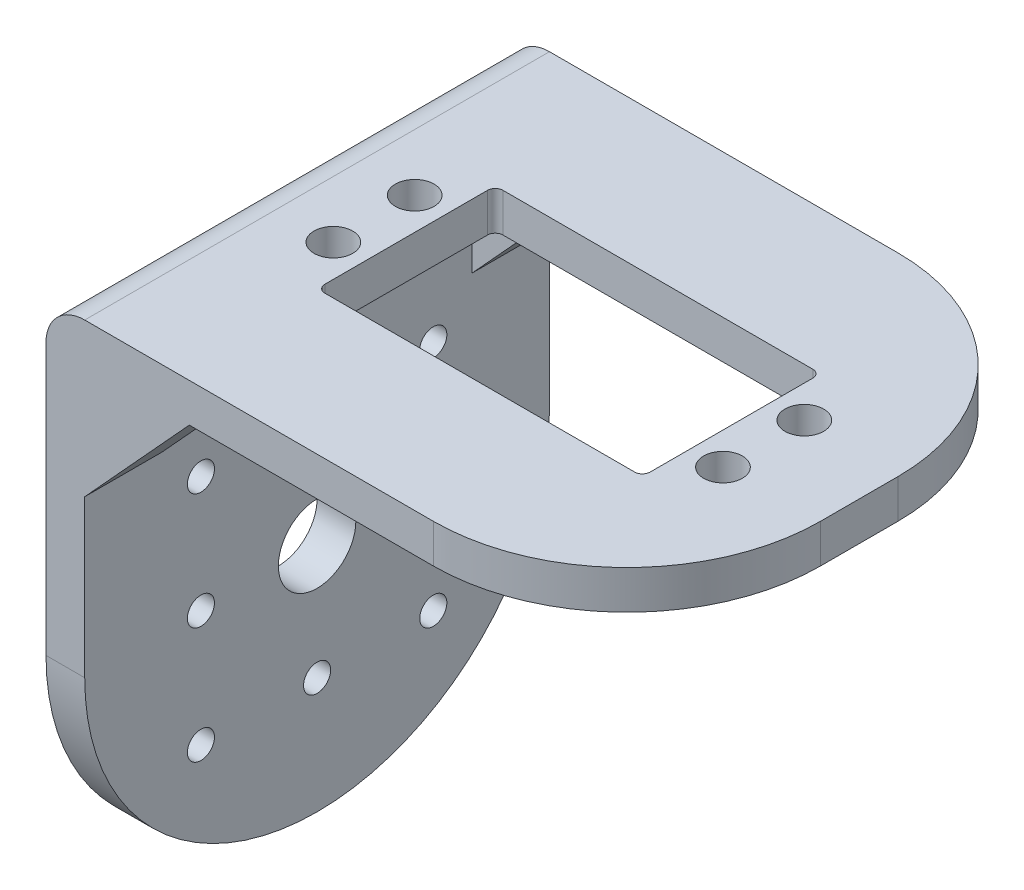
from build123d import *

# Parameters (mm, degrees)
BOSS_EXTRUDE1_DEPTH = 5
CUT_EXTRUDE1_REACH  = 58.403
SKETCH2_R           = 1.75
SKETCH4_W           = 75
SKETCH4_H           = 60
BOSS_EXTRUDE2_DEPTH = 5
CUT_EXTRUDE2_REACH  = 90.459
SKETCH3_R           = 2.5
SKETCH3_W           = 23
SKETCH3_H           = 42
FILLET1_R           = 25
FILLET2_R           = 5
FILLET3_R           = 2
FILLET4_R           = 1
BOSS_EXTRUDE3_DEPTH = 10
LPATTERN1_COUNT     = 2
LPATTERN1_PITCH     = 50
CUT_EXTRUDE3_REACH  = 95.708
SKETCH7_R           = 5


with BuildPart() as part:
    # Sketch1 → Boss-Extrude1 (new body)
    with BuildSketch(Plane(origin=(0, 0, 0), x_dir=(0, 0, -1), z_dir=(1, 0, 0))):
        with BuildLine():
            ThreePointArc((-30, -17.5), (0, -47.5), (30, -17.5))
            Line((30, -17.5), (30, 17.5))
            Line((30, 17.5), (-30, 17.5))
            Line((-30, 17.5), (-30, -17.5))
        make_face()
    extrude(amount=BOSS_EXTRUDE1_DEPTH)

    # Sketch2 → Cut-Extrude1 (cut, up to next)
    with BuildSketch(Plane(origin=(5, 0, 0), x_dir=(0, 0, -1), z_dir=(1, 0, 0)), mode=Mode.PRIVATE) as cut_extrude1_sk1:
        with Locations((-15, -32.5)):
            Circle(SKETCH2_R)
    cut_extrude1_tool1 = extrude(cut_extrude1_sk1.sketch, amount=-CUT_EXTRUDE1_REACH, mode=Mode.PRIVATE) & part.part
    # Sketch2 → Cut-Extrude1 (cut, up to next)
    with BuildSketch(Plane(origin=(5, 0, 0), x_dir=(0, 0, -1), z_dir=(1, 0, 0)), mode=Mode.PRIVATE) as cut_extrude1_sk2:
        with Locations((15, -32.5)):
            Circle(SKETCH2_R)
    cut_extrude1_tool2 = extrude(cut_extrude1_sk2.sketch, amount=-CUT_EXTRUDE1_REACH, mode=Mode.PRIVATE) & part.part
    # Sketch2 → Cut-Extrude1 (cut, up to next)
    with BuildSketch(Plane(origin=(5, 0, 0), x_dir=(0, 0, -1), z_dir=(1, 0, 0)), mode=Mode.PRIVATE) as cut_extrude1_sk3:
        with Locations((-15, -2.5)):
            Circle(SKETCH2_R)
    cut_extrude1_tool3 = extrude(cut_extrude1_sk3.sketch, amount=-CUT_EXTRUDE1_REACH, mode=Mode.PRIVATE) & part.part
    # Sketch2 → Cut-Extrude1 (cut, up to next)
    with BuildSketch(Plane(origin=(5, 0, 0), x_dir=(0, 0, -1), z_dir=(1, 0, 0)), mode=Mode.PRIVATE) as cut_extrude1_sk4:
        with Locations((0, -2.5)):
            Circle(SKETCH2_R)
    cut_extrude1_tool4 = extrude(cut_extrude1_sk4.sketch, amount=-CUT_EXTRUDE1_REACH, mode=Mode.PRIVATE) & part.part
    # Sketch2 → Cut-Extrude1 (cut, up to next)
    with BuildSketch(Plane(origin=(5, 0, 0), x_dir=(0, 0, -1), z_dir=(1, 0, 0)), mode=Mode.PRIVATE) as cut_extrude1_sk5:
        with Locations((15, -2.5)):
            Circle(SKETCH2_R)
    cut_extrude1_tool5 = extrude(cut_extrude1_sk5.sketch, amount=-CUT_EXTRUDE1_REACH, mode=Mode.PRIVATE) & part.part
    # Sketch2 → Cut-Extrude1 (cut, up to next)
    with BuildSketch(Plane(origin=(5, 0, 0), x_dir=(0, 0, -1), z_dir=(1, 0, 0)), mode=Mode.PRIVATE) as cut_extrude1_sk6:
        with Locations((0, -32.5)):
            Circle(SKETCH2_R)
    cut_extrude1_tool6 = extrude(cut_extrude1_sk6.sketch, amount=-CUT_EXTRUDE1_REACH, mode=Mode.PRIVATE) & part.part
    # Sketch2 → Cut-Extrude1 (cut, up to next)
    with BuildSketch(Plane(origin=(5, 0, 0), x_dir=(0, 0, -1), z_dir=(1, 0, 0)), mode=Mode.PRIVATE) as cut_extrude1_sk7:
        with Locations((-15, -17.5)):
            Circle(SKETCH2_R)
    cut_extrude1_tool7 = extrude(cut_extrude1_sk7.sketch, amount=-CUT_EXTRUDE1_REACH, mode=Mode.PRIVATE) & part.part
    # Sketch2 → Cut-Extrude1 (cut, up to next)
    with BuildSketch(Plane(origin=(5, 0, 0), x_dir=(0, 0, -1), z_dir=(1, 0, 0)), mode=Mode.PRIVATE) as cut_extrude1_sk8:
        with Locations((15, -17.5)):
            Circle(SKETCH2_R)
    cut_extrude1_tool8 = extrude(cut_extrude1_sk8.sketch, amount=-CUT_EXTRUDE1_REACH, mode=Mode.PRIVATE) & part.part
    add(cut_extrude1_tool1.solids().sort_by_distance((5, -32.5, 15))[0], mode=Mode.SUBTRACT)
    add(cut_extrude1_tool2.solids().sort_by_distance((5, -32.5, -15))[0], mode=Mode.SUBTRACT)
    add(cut_extrude1_tool3.solids().sort_by_distance((5, -2.5, 15))[0], mode=Mode.SUBTRACT)
    add(cut_extrude1_tool4.solids().sort_by_distance((5, -2.5, 0))[0], mode=Mode.SUBTRACT)
    add(cut_extrude1_tool5.solids().sort_by_distance((5, -2.5, -15))[0], mode=Mode.SUBTRACT)
    add(cut_extrude1_tool6.solids().sort_by_distance((5, -32.5, 0))[0], mode=Mode.SUBTRACT)
    add(cut_extrude1_tool7.solids().sort_by_distance((5, -17.5, 15))[0], mode=Mode.SUBTRACT)
    add(cut_extrude1_tool8.solids().sort_by_distance((5, -17.5, -15))[0], mode=Mode.SUBTRACT)

    # Sketch4 → Boss-Extrude2 (add)
    with BuildSketch(Plane(origin=(0, 17.5, 0), x_dir=(1, 0, 0), z_dir=(0, 1, 0))):
        with Locations((37.5, 0)):
            Rectangle(SKETCH4_W, SKETCH4_H)
    extrude(amount=BOSS_EXTRUDE2_DEPTH)

    # Sketch3 → Cut-Extrude2 (cut, up to next)
    with BuildSketch(Plane(origin=(30, 22.5, 0), x_dir=(0, 0, -1), z_dir=(0, 1, 0)), mode=Mode.PRIVATE) as cut_extrude2_sk1:
        with Locations((-5.25, 17.65)):
            Circle(SKETCH3_R)
    cut_extrude2_tool1 = extrude(cut_extrude2_sk1.sketch, amount=-CUT_EXTRUDE2_REACH, mode=Mode.PRIVATE) & part.part
    # Sketch3 → Cut-Extrude2 (cut, up to next)
    with BuildSketch(Plane(origin=(30, 22.5, 0), x_dir=(0, 0, -1), z_dir=(0, 1, 0)), mode=Mode.PRIVATE) as cut_extrude2_sk2:
        with Locations((5.25, 17.65)):
            Circle(SKETCH3_R)
    cut_extrude2_tool2 = extrude(cut_extrude2_sk2.sketch, amount=-CUT_EXTRUDE2_REACH, mode=Mode.PRIVATE) & part.part
    # Sketch3 → Cut-Extrude2 (cut, up to next)
    with BuildSketch(Plane(origin=(30, 22.5, 0), x_dir=(0, 0, -1), z_dir=(0, 1, 0)), mode=Mode.PRIVATE) as cut_extrude2_sk3:
        with Locations((5.25, -32.65)):
            Circle(SKETCH3_R)
    cut_extrude2_tool3 = extrude(cut_extrude2_sk3.sketch, amount=-CUT_EXTRUDE2_REACH, mode=Mode.PRIVATE) & part.part
    # Sketch3 → Cut-Extrude2 (cut, up to next)
    with BuildSketch(Plane(origin=(30, 22.5, 0), x_dir=(0, 0, -1), z_dir=(0, 1, 0)), mode=Mode.PRIVATE) as cut_extrude2_sk4:
        with Locations((-5.25, -32.65)):
            Circle(SKETCH3_R)
    cut_extrude2_tool4 = extrude(cut_extrude2_sk4.sketch, amount=-CUT_EXTRUDE2_REACH, mode=Mode.PRIVATE) & part.part
    # Sketch3 → Cut-Extrude2 (cut, up to next)
    with BuildSketch(Plane(origin=(30, 22.5, 0), x_dir=(0, 0, -1), z_dir=(0, 1, 0)), mode=Mode.PRIVATE) as cut_extrude2_sk5:
        with Locations((0, -7.5)):
            Rectangle(SKETCH3_W, SKETCH3_H)
    cut_extrude2_tool5 = extrude(cut_extrude2_sk5.sketch, amount=-CUT_EXTRUDE2_REACH, mode=Mode.PRIVATE) & part.part
    add(cut_extrude2_tool1.solids().sort_by_distance((12.35, 22.5, 5.25))[0], mode=Mode.SUBTRACT)
    add(cut_extrude2_tool2.solids().sort_by_distance((12.35, 22.5, -5.25))[0], mode=Mode.SUBTRACT)
    add(cut_extrude2_tool3.solids().sort_by_distance((62.65, 22.5, -5.25))[0], mode=Mode.SUBTRACT)
    add(cut_extrude2_tool4.solids().sort_by_distance((62.65, 22.5, 5.25))[0], mode=Mode.SUBTRACT)
    add(cut_extrude2_tool5.solids().sort_by_distance((37.5, 22.5, 0))[0], mode=Mode.SUBTRACT)

    # Fillet1
    fillet1_edges = [part.edges().sort_by_distance(p)[0] for p in [
        (75, 20, -30),
        (75, 20, 30),
    ]]
    fillet(fillet1_edges, radius=FILLET1_R)

    # Fillet2
    fillet2_edges = [part.edges().sort_by_distance(p)[0] for p in [
        (0, 22.5, 0),
    ]]
    fillet(fillet2_edges, radius=FILLET2_R)

    # Fillet3
    fillet3_edges = [part.edges().sort_by_distance(p)[0] for p in [
        (5, 17.5, 0),
    ]]
    fillet(fillet3_edges, radius=FILLET3_R)

    # Fillet4
    fillet4_edges = [part.edges().sort_by_distance(p)[0] for p in [
        (16.5, 20, -11.5),
        (58.5, 20, -11.5),
        (58.5, 20, 11.5),
        (16.5, 20, 11.5),
    ]]
    fillet(fillet4_edges, radius=FILLET4_R)

    # Sketch6 → Boss-Extrude3 (add)
    with BuildSketch(Plane.XY.offset(30)):
        Polygon((18.5, 17.5), (5, 2.743645437), (5, 17.5), align=None)
    boss_extrude3 = extrude(amount=-BOSS_EXTRUDE3_DEPTH)

    # LPattern1: Boss-Extrude3 ×2
    with Locations(*[(0, 0, -i * LPATTERN1_PITCH) for i in range(1, LPATTERN1_COUNT)]):
        add(boss_extrude3)

    # Sketch7 → Cut-Extrude3 (cut, up to next)
    with BuildSketch(Plane.ZY, mode=Mode.PRIVATE) as cut_extrude3_sk1:
        with Locations((0, -17.5)):
            Circle(SKETCH7_R)
    cut_extrude3_tool1 = extrude(cut_extrude3_sk1.sketch, amount=-CUT_EXTRUDE3_REACH, mode=Mode.PRIVATE) & part.part
    add(cut_extrude3_tool1.solids().sort_by_distance((0, -17.5, 0))[0], mode=Mode.SUBTRACT)


solid = part.part
